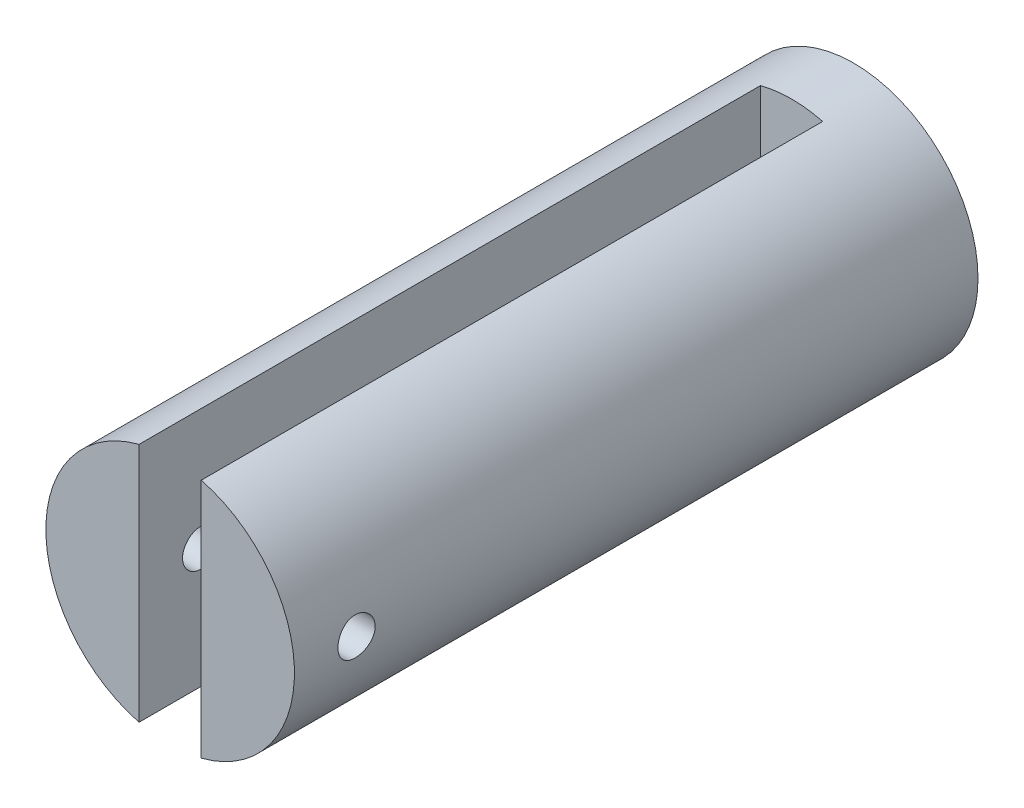
from build123d import *

# Parameters (mm, degrees)
CROQUIS1_R              = 10
CROQUIS1_R_2            = 2.5
SALIENTE_EXTRUIR1_DEPTH = 5
SALIENTE_EXTRUIR2_DEPTH = 50
CROQUIS3_R              = 1.5
CORTAR_EXTRUIR1_DEPTH   = 20
CROQUIS6_R              = 3.75
CORTAR_EXTRUIR3_DEPTH   = 42.5


with BuildPart() as part:
    # Croquis1 → Saliente-Extruir1 (new body)
    with BuildSketch(Plane.XY):
        Circle(CROQUIS1_R)
        Circle(CROQUIS1_R_2, mode=Mode.SUBTRACT)
    extrude(amount=SALIENTE_EXTRUIR1_DEPTH)

    # Croquis2 → Saliente-Extruir2 (add)
    with BuildSketch(Plane.XY.offset(5)):
        with BuildLine():
            Line((-2.5, -9.682458366), (-2.5, 9.682458366))
            ThreePointArc((-2.5, 9.682458366), (-10, 0), (-2.5, -9.682458366))
        make_face()
        with BuildLine():
            Line((2.5, -9.682458366), (2.5, 9.682458366))
            ThreePointArc((2.5, 9.682458366), (10, 0), (2.5, -9.682458366))
        make_face()
    extrude(amount=SALIENTE_EXTRUIR2_DEPTH)

    # Croquis3 → Cortar-Extruir1 (cut, symmetric)
    with BuildSketch(Plane.ZY.offset(-2.5)):
        with Locations((50, 0)):
            Circle(CROQUIS3_R)
    extrude(amount=CORTAR_EXTRUIR1_DEPTH, both=True, mode=Mode.SUBTRACT)

    # Croquis6 → Cortar-Extruir3 (cut)
    with BuildSketch(Plane.XY.offset(45)):
        Circle(CROQUIS6_R)
    extrude(amount=-CORTAR_EXTRUIR3_DEPTH, mode=Mode.SUBTRACT)


solid = part.part
